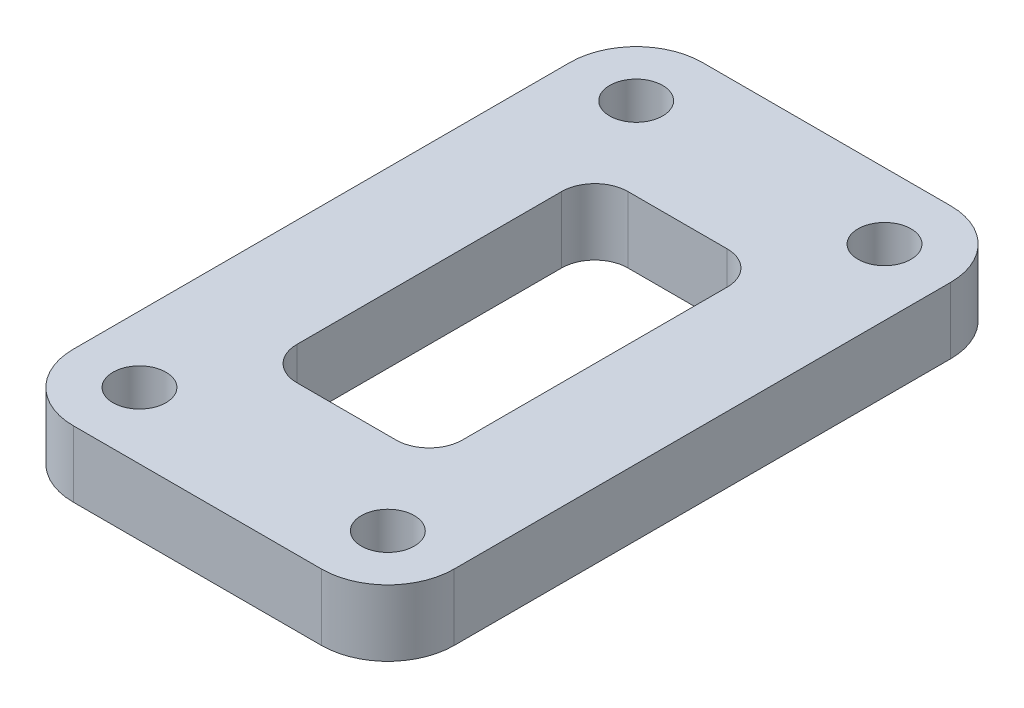
from build123d import *

# Parameters (mm, degrees)
SKETCH1_R           = 1.6
BOSS_EXTRUDE1_DEPTH = 4
CUT_EXTRUDE1_DEPTH  = 23.566568193


with BuildPart() as part:
    # Sketch1 → Boss-Extrude1 (new body)
    with BuildSketch(Plane(origin=(0, 0, 0), x_dir=(1, 0, 0), z_dir=(0, 1, 0))):
        with BuildLine():
            Line((-11.5, 15), (-11.5, -15))
            ThreePointArc((-11.5, -15), (-10.328427125, -17.828427125), (-7.5, -19))
            Line((-7.5, -19), (7.5, -19))
            ThreePointArc((7.5, -19), (10.328427125, -17.828427125), (11.5, -15))
            Line((11.5, -15), (11.5, 15))
            ThreePointArc((11.5, 15), (10.328427125, 17.828427125), (7.5, 19))
            Line((7.5, 19), (-7.5, 19))
            ThreePointArc((-7.5, 19), (-10.328427125, 17.828427125), (-11.5, 15))
        make_face()
        with Locations(Location((-7.5, 15, 0), (0, 0, 270))):
            Circle(SKETCH1_R, mode=Mode.SUBTRACT)
        with Locations(Location((7.5, 15, 0), (0, 0, 270))):
            Circle(SKETCH1_R, mode=Mode.SUBTRACT)
        with Locations(Location((-7.5, -15, 0), (0, 0, 270))):
            Circle(SKETCH1_R, mode=Mode.SUBTRACT)
        with Locations(Location((7.5, -15, 0), (0, 0, 270))):
            Circle(SKETCH1_R, mode=Mode.SUBTRACT)
    extrude(amount=BOSS_EXTRUDE1_DEPTH)

    # Sketch2 → Cut-Extrude1 (cut, through all)
    with BuildSketch(Plane(origin=(0, 4, 0), x_dir=(1, 0, 0), z_dir=(0, 1, 0))):
        with BuildLine():
            Line((-3, 10), (3, 10))
            ThreePointArc((3, 10), (4.414213562, 9.414213562), (5, 8))
            Line((5, 8), (5, -8))
            ThreePointArc((5, -8), (4.414213562, -9.414213562), (3, -10))
            Line((3, -10), (-3, -10))
            ThreePointArc((-3, -10), (-4.414213562, -9.414213562), (-5, -8))
            Line((-5, -8), (-5, 8))
            ThreePointArc((-5, 8), (-4.414213562, 9.414213562), (-3, 10))
        make_face()
    extrude(amount=-CUT_EXTRUDE1_DEPTH, mode=Mode.SUBTRACT)


solid = part.part
